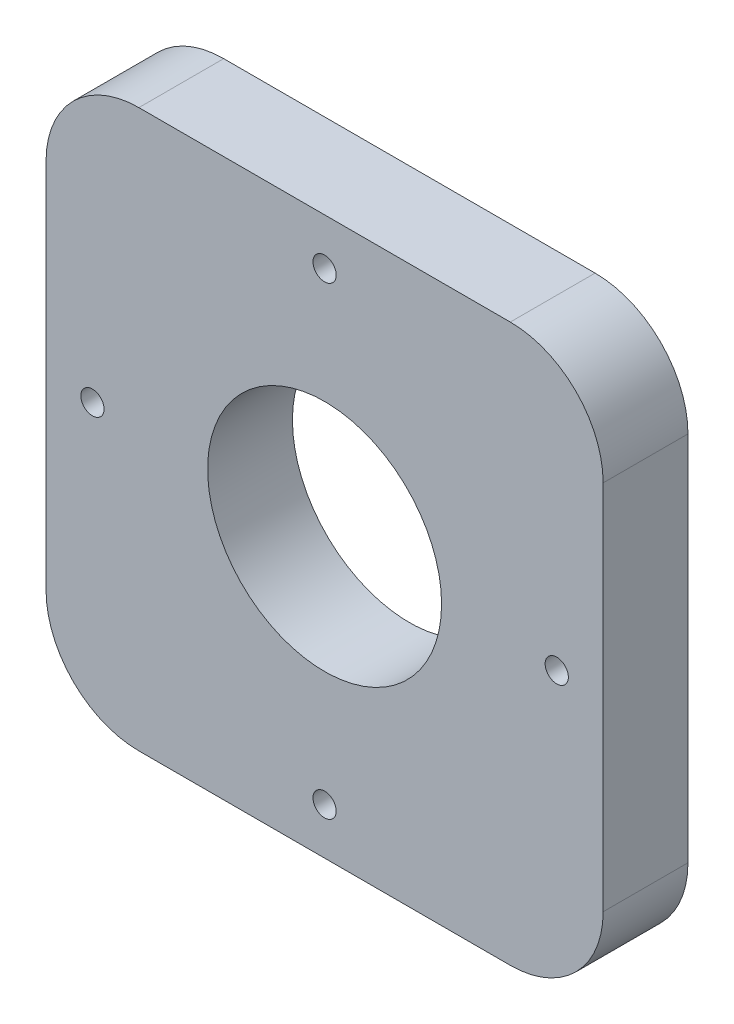
from build123d import *

# Parameters (mm, degrees)
SKETCH1_W           = 38.1
SKETCH1_H           = 38.1
BOSS_EXTRUDE1_DEPTH = 5.8
SKETCH2_R           = 0.79375
CUT_EXTRUDE1_DEPTH  = 28.558029683
SKETCH3_R           = 8
CUT_EXTRUDE2_DEPTH  = 12.7
FILLET1_R           = 6.35


with BuildPart() as part:
    # Sketch1 → Boss-Extrude1 (new body)
    with BuildSketch(Plane.XY):
        Rectangle(SKETCH1_W, SKETCH1_H)
    extrude(amount=BOSS_EXTRUDE1_DEPTH)

    # Sketch2 → Cut-Extrude1 (cut, through all)
    with BuildSketch(Plane.XY.offset(5.8)):
        with Locations((0, 15.875)):
            Circle(SKETCH2_R)
        with Locations((15.875, 0)):
            Circle(SKETCH2_R)
        with Locations((0, -15.875)):
            Circle(SKETCH2_R)
        with Locations((-15.875, 0)):
            Circle(SKETCH2_R)
    extrude(amount=-CUT_EXTRUDE1_DEPTH, mode=Mode.SUBTRACT)

    # Sketch3 → Cut-Extrude2 (cut)
    with BuildSketch(Plane.XY.offset(5.8)):
        Circle(SKETCH3_R)
    extrude(amount=-CUT_EXTRUDE2_DEPTH, mode=Mode.SUBTRACT)

    # Fillet1
    fillet1_edges = [part.edges().sort_by_distance(p)[0] for p in [
        (19.05, -19.05, 2.9),
        (-19.05, -19.05, 2.9),
        (-19.05, 19.05, 2.9),
        (19.05, 19.05, 2.9),
    ]]
    fillet(fillet1_edges, radius=FILLET1_R)


solid = part.part
